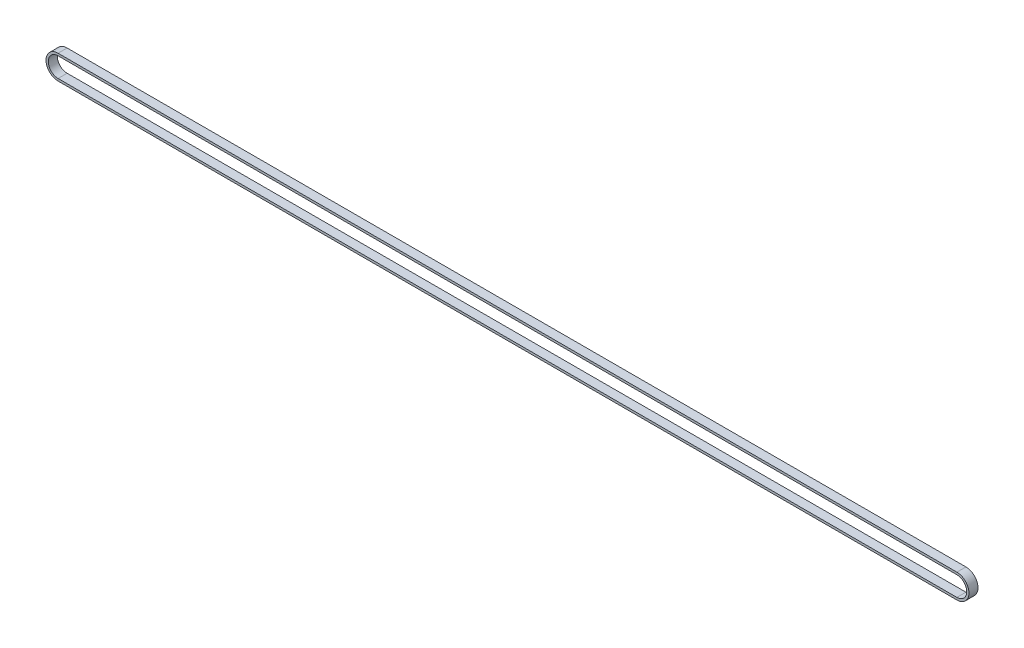
from build123d import *

# Parameters (mm, degrees)
EXTRUDE_THIN1_DEPTH = 3


with BuildPart() as part:
    # Sketch1 → Extrude-Thin1 (new, symmetric)
    with BuildSketch(Plane.XY):
        with BuildLine():
            Line((298, 1), (-298, 1))
            ThreePointArc((-298, 1), (-306, -7), (-298, -15))
            Line((-298, -15), (298, -15))
            ThreePointArc((298, -15), (306, -7), (298, 1))
        make_face()
        with BuildLine():
            Line((298, -0.5), (-298, -0.5))
            ThreePointArc((-298, -0.5), (-304.5, -7), (-298, -13.5))
            Line((-298, -13.5), (298, -13.5))
            ThreePointArc((298, -13.5), (304.5, -7), (298, -0.5))
        make_face(mode=Mode.SUBTRACT)
    extrude(amount=EXTRUDE_THIN1_DEPTH, both=True)


solid = part.part
